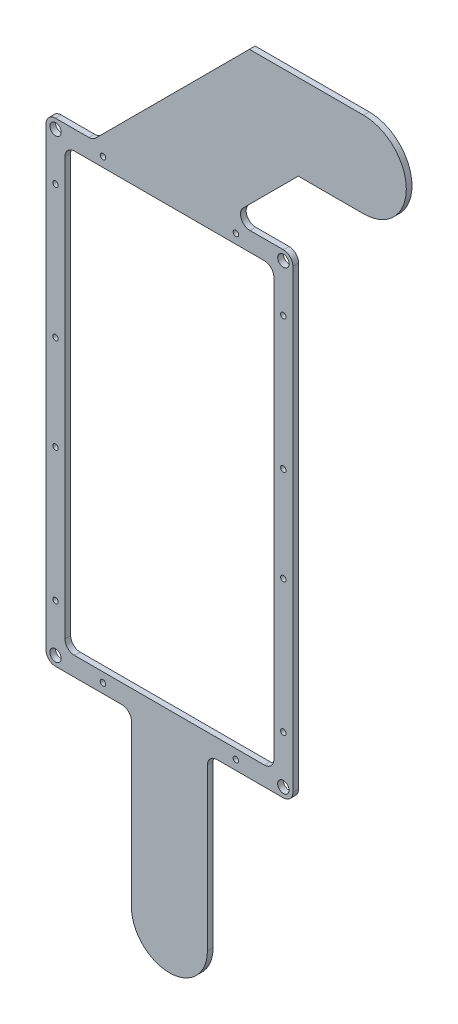
from build123d import *

# Parameters (mm, degrees)
SKETCH1_R           = 3
BOSS_EXTRUDE1_DEPTH = 10
SKETCH2_R           = 1.45
CUT_EXTRUDE1_DEPTH  = 142.244468918
BOSS_EXTRUDE2_DEPTH = 10
BOSS_EXTRUDE3_DEPTH = 10
SKETCH8_W           = 62.731065403
SKETCH8_H           = 467.056503757
CUT_EXTRUDE5_DEPTH  = 303.045371757


with BuildPart() as part:
    # Sketch1 → Boss-Extrude1 (new body)
    with BuildSketch(Plane.XY):
        with BuildLine():
            Line((-60, -125), (60, -125))
            ThreePointArc((60, -125), (63.535533906, -123.535533906), (65, -120))
            Line((65, -120), (65, 120))
            ThreePointArc((65, 120), (63.535533906, 123.535533906), (60, 125))
            Line((60, 125), (-60, 125))
            ThreePointArc((-60, 125), (-63.535533906, 123.535533906), (-65, 120))
            Line((-65, 120), (-65, -120))
            ThreePointArc((-65, -120), (-63.535533906, -123.535533906), (-60, -125))
        make_face()
        with Locations((-60, 120)):
            Circle(SKETCH1_R, mode=Mode.SUBTRACT)
        with Locations((60, 120)):
            Circle(SKETCH1_R, mode=Mode.SUBTRACT)
        with Locations((-60, -120)):
            Circle(SKETCH1_R, mode=Mode.SUBTRACT)
        with Locations((60, -120)):
            Circle(SKETCH1_R, mode=Mode.SUBTRACT)
        with BuildLine():
            Line((-50, -115), (50, -115))
            ThreePointArc((50, -115), (53.535533906, -113.535533906), (55, -110))
            Line((55, -110), (55, 110))
            ThreePointArc((55, 110), (53.535533906, 113.535533906), (50, 115))
            Line((50, 115), (-50, 115))
            ThreePointArc((-50, 115), (-53.535533906, 113.535533906), (-55, 110))
            Line((-55, 110), (-55, -110))
            ThreePointArc((-55, -110), (-53.535533906, -113.535533906), (-50, -115))
        make_face(mode=Mode.SUBTRACT)
    extrude(amount=BOSS_EXTRUDE1_DEPTH)

    # Sketch2 → Cut-Extrude1 (cut, through all)
    with BuildSketch(Plane(origin=(0, 0, 0), x_dir=(-1, 0, 0), z_dir=(0, 0, -1))):
        with Locations((-35, 120)):
            Circle(SKETCH2_R)
        with Locations((-60, 95)):
            Circle(SKETCH2_R)
        with Locations((-60, 25)):
            Circle(SKETCH2_R)
        with Locations(Location((-60, -25, 0), (0, 0, 180))):
            Circle(SKETCH2_R)
        with Locations(Location((-60, -95, 0), (0, 0, 180))):
            Circle(SKETCH2_R)
        with Locations(Location((-35, -120, 0), (0, 0, 180))):
            Circle(SKETCH2_R)
        with Locations((35, -120)):
            Circle(SKETCH2_R)
        with Locations((60, -95)):
            Circle(SKETCH2_R)
        with Locations((60, -25)):
            Circle(SKETCH2_R)
        with Locations(Location((60, 25, 0), (0, 0, 180))):
            Circle(SKETCH2_R)
        with Locations(Location((60, 95, 0), (0, 0, 180))):
            Circle(SKETCH2_R)
        with Locations(Location((35, 120, 0), (0, 0, 180))):
            Circle(SKETCH2_R)
    extrude(amount=-CUT_EXTRUDE1_DEPTH, mode=Mode.SUBTRACT)

    # Sketch3 → Boss-Extrude2 (add, through all)
    with BuildSketch(Plane.XY.offset(10)):
        with BuildLine():
            Line((-20, -214.79), (-20, -130))
            ThreePointArc((-20, -130), (-21.464466094, -126.464466094), (-25, -125))
            Line((-25, -125), (25, -125))
            ThreePointArc((25, -125), (21.464466094, -126.464466094), (20, -130))
            Line((20, -130), (20, -214.79))
            ThreePointArc((20, -214.79), (0, -234.79), (-20, -214.79))
        make_face()
    extrude(amount=-BOSS_EXTRUDE2_DEPTH)

    # Sketch5 → Boss-Extrude3 (add)
    with BuildSketch(Plane.XY.offset(10)):
        with BuildLine():
            ThreePointArc((-38.890872965, 126.464466094), (-40.512989709, 125.380602337), (-42.426406871, 125))
            Line((-42.426406871, 125), (42.426406871, 125))
            ThreePointArc((42.426406871, 125), (37.807009209, 128.086582838), (38.890872965, 133.535533906))
            Line((38.890872965, 133.535533906), (67.855339059, 162.5))
            Line((67.855339059, 162.5), (102.25, 162.5))
            ThreePointArc((102.25, 162.5), (124.75, 185), (102.25, 207.5))
            Line((102.25, 207.5), (42.144660941, 207.5))
            Line((42.144660941, 207.5), (-38.890872965, 126.464466094))
        make_face()
    extrude(amount=-BOSS_EXTRUDE3_DEPTH)

    # Sketch8 → Cut-Extrude5 (cut, through all)
    with BuildSketch(Plane.ZY.offset(65)):
        with Locations((34.365532702, -16.017183146)):
            Rectangle(SKETCH8_W, SKETCH8_H)
    extrude(amount=-CUT_EXTRUDE5_DEPTH, mode=Mode.SUBTRACT)


solid = part.part
